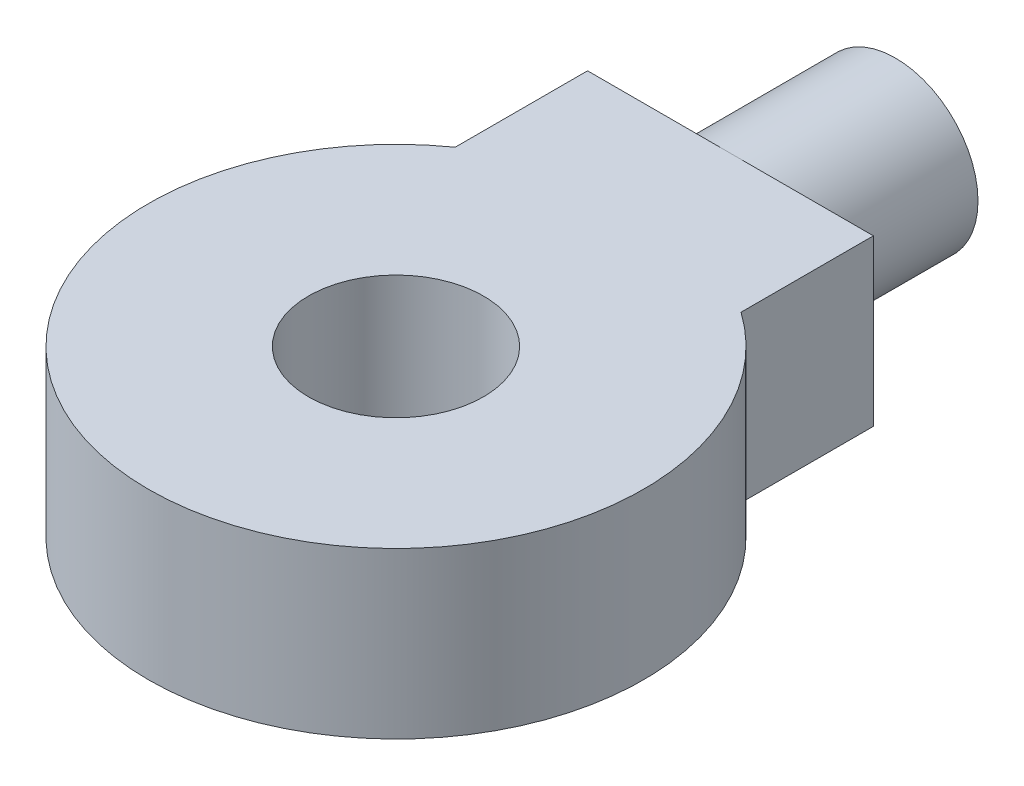
from build123d import *

# Parameters (mm, degrees)
SKETCH1_R           = 2.5
BOSS_EXTRUDE1_DEPTH = 5
SKETCH2_W           = 8.660254038
SKETCH2_H           = 5
BOSS_EXTRUDE2_DEPTH = 11
SKETCH3_R           = 7.5
BOSS_EXTRUDE3_DEPTH = 5
SKETCH4_R           = 2.65
CUT_EXTRUDE1_DEPTH  = 36.309767636


with BuildPart() as part:
    # Sketch1 → Boss-Extrude1 (new body)
    with BuildSketch(Plane.XY.offset(2.596184677)):
        with Locations((21.004809472, 129.315154096)):
            Circle(SKETCH1_R)
    extrude(amount=-BOSS_EXTRUDE1_DEPTH)

    # Sketch2 → Boss-Extrude2 (add)
    with BuildSketch(Plane.XY.offset(2.596184677)):
        with Locations((21.004809472, 129.315154096)):
            Rectangle(SKETCH2_W, SKETCH2_H)
    extrude(amount=BOSS_EXTRUDE2_DEPTH)

    # Sketch3 → Boss-Extrude3 (add)
    with BuildSketch(Plane(origin=(0, 131.815154096, 0), x_dir=(1, 0, 0), z_dir=(0, 1, 0))):
        with Locations((21.004809472, -12.730064941)):
            Circle(SKETCH3_R)
    extrude(amount=-BOSS_EXTRUDE3_DEPTH)

    # Sketch4 → Cut-Extrude1 (cut, through all)
    with BuildSketch(Plane(origin=(0, 131.815154096, 0), x_dir=(1, 0, 0), z_dir=(0, 1, 0))):
        with Locations(Location((21.004809472, -12.730064941, 0), (0, 0, 270))):
            Circle(SKETCH4_R)
    extrude(amount=-CUT_EXTRUDE1_DEPTH, mode=Mode.SUBTRACT)


with BuildPart() as part_1:
    # Body-Move/Copy1: moved
    add(part.part.moved(Location((-21, -129.32, -12.73))))


solid = part_1.part
